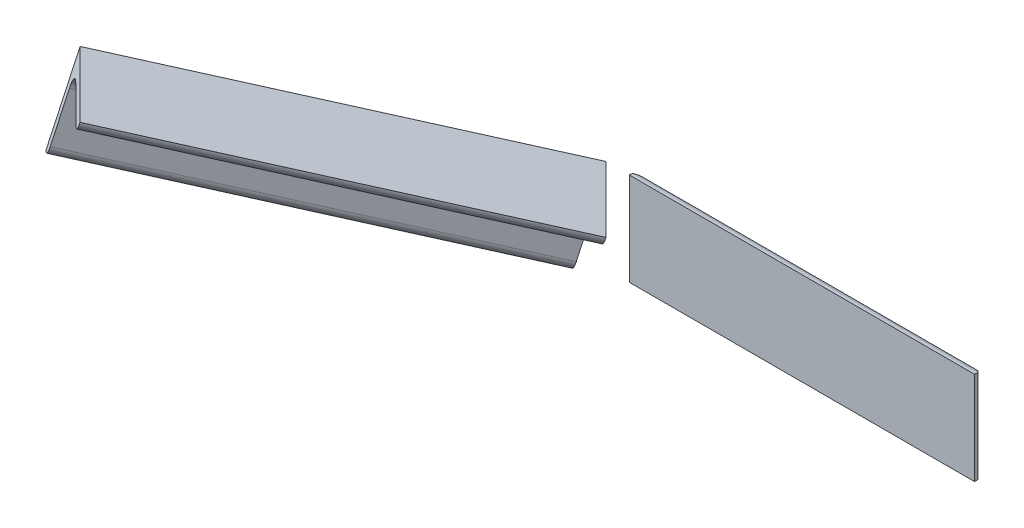
from build123d import *

# Parameters (mm, degrees)
STRUCTURAL_MEMBER1_DEPTH = 94.292689271
CUT_EXTRUDE2_DEPTH       = 107.86098869
STRUCTURAL_MEMBER4_DEPTH = 105.18405993


with BuildPart() as part:
    # Sketch1 → Structural Member1 (new body)
    with BuildSketch(Plane(origin=(6.35, 0, 0), x_dir=(0, 0, -1), z_dir=(1, 0, 0))):
        with BuildLine():
            Line((0, 0), (0, 25.4))
            Line((0, 25.4), (0.00508, 25.4))
            ThreePointArc((0.00508, 25.4), (2.246551928, 24.471551928), (3.175, 22.23008))
            Line((3.175, 22.23008), (3.175, 7.9375))
            ThreePointArc((3.175, 7.9375), (4.569903955, 4.569903955), (7.9375, 3.175))
            Line((7.9375, 3.175), (22.23008, 3.175))
            ThreePointArc((22.23008, 3.175), (24.471551928, 2.246551928), (25.4, 0.00508))
            Line((25.4, 0.00508), (25.4, 0))
            Line((25.4, 0), (0, 0))
        make_face()
    extrude(amount=STRUCTURAL_MEMBER1_DEPTH)

    # Sketch12 → Cut-Extrude2 (cut, through all)
    with BuildSketch(Plane(origin=(0, 0, 0), x_dir=(1, 0, 0), z_dir=(0, 1, 0))):
        Polygon((6.35, 25.4), (6.35, 6.35), (25.4, 25.4), align=None)
        Polygon((25.4, 25.4), (6.35, 6.35), (6.35, 0.961846327), (30.788153673, 25.4), align=None)
    cut_extrude2 = extrude(amount=CUT_EXTRUDE2_DEPTH, mode=Mode.SUBTRACT)

    # Mirror2: Cut-Extrude2 across plane
    add(cut_extrude2.mirror(Plane(origin=(53.496344636, 0, 0), x_dir=(0, 0, 1), z_dir=(1, 0, 0))), mode=Mode.SUBTRACT)


with BuildPart() as body_2:
    # Sketch17 → Structural Member4 (new body)
    with BuildSketch(Plane(origin=(0, 25.4, 0), x_dir=(-0.1830127018922193, -0.9659258262890682, 0.18301270189221994), z_dir=(-0.6830127018922181, 0.2588190451025212, 0.6830127018922205))):
        with BuildLine():
            Line((0, 0), (0, 25.4))
            Line((0, 25.4), (0.00508, 25.4))
            ThreePointArc((0.00508, 25.4), (2.246551928, 24.471551928), (3.175, 22.23008))
            Line((3.175, 22.23008), (3.175, 7.9375))
            ThreePointArc((3.175, 7.9375), (4.569903955, 4.569903955), (7.9375, 3.175))
            Line((7.9375, 3.175), (22.23008, 3.175))
            ThreePointArc((22.23008, 3.175), (24.471551928, 2.246551928), (25.4, 0.00508))
            Line((25.4, 0.00508), (25.4, 0))
            Line((25.4, 0), (0, 0))
        make_face()
    extrude(amount=STRUCTURAL_MEMBER4_DEPTH)


solid = Compound([part.part, body_2.part])
